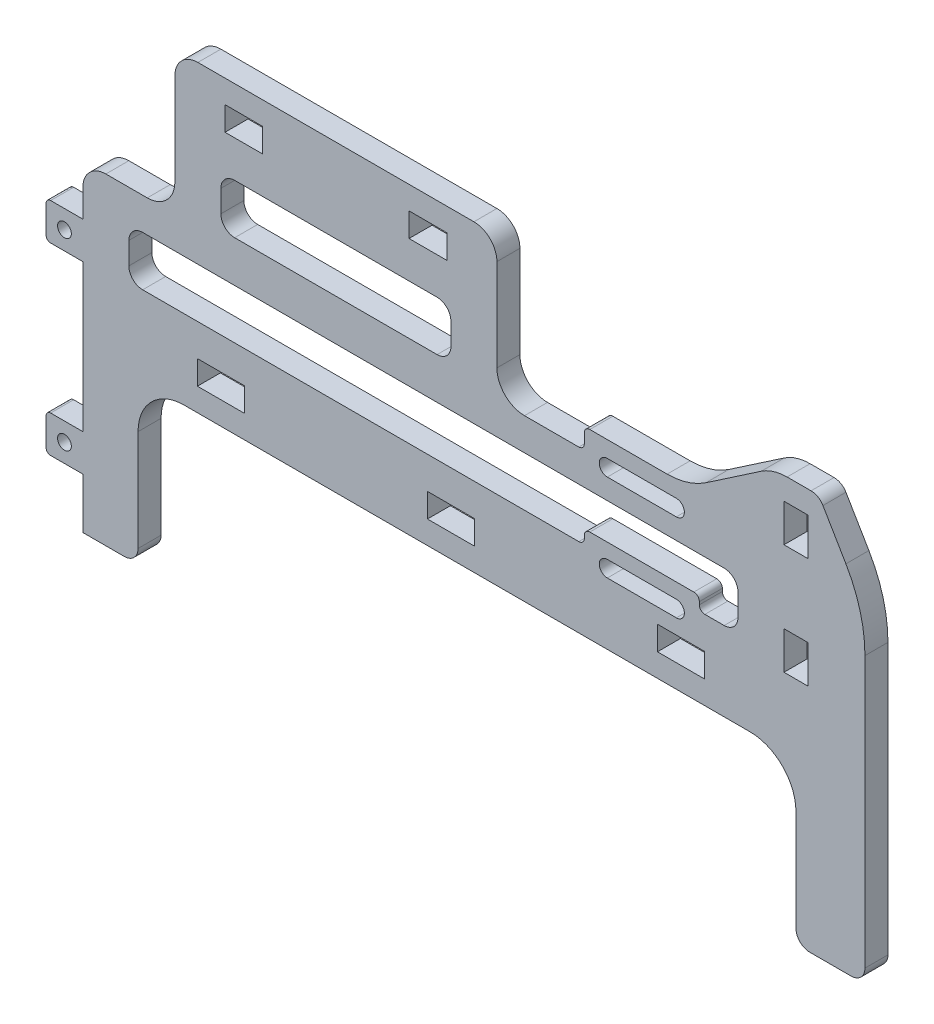
from build123d import *

# Parameters (mm, degrees)
SALIENTE_EXTRUIR1_DEPTH = 5
CROQUIS2_W              = 143
CROQUIS2_H              = 35
CORTAR_EXTRUIR1_DEPTH   = 5
REDONDEO1_R             = 10
CROQUIS3_W              = 5
CROQUIS3_H              = 8
SALIENTE_EXTRUIR2_DEPTH = 8
REDONDEO2_R             = 30
REDONDEO3_R             = 3
CROQUIS4_W              = 5.2
CROQUIS4_H              = 8.2
CORTAR_EXTRUIR2_DEPTH   = 192.034028382
REDONDEO4_R             = 3
REDONDEO5_R             = 10
REDONDEO6_R             = 1
CROQUIS5_R              = 1.5
CORTAR_EXTRUIR3_DEPTH   = 5
CROQUIS6_W              = 10.2
CROQUIS6_H              = 5.2
CORTAR_EXTRUIR4_DEPTH   = 5
CROQUIS7_W              = 132.4
CROQUIS7_H              = 10.8
CORTAR_EXTRUIR5_DEPTH   = 5
CROQUIS8_W              = 70
CROQUIS8_H              = 31
SALIENTE_EXTRUIR3_DEPTH = 5
CROQUIS9_W              = 8.2
CROQUIS9_H              = 5.2
CORTAR_EXTRUIR6_DEPTH   = 5
CROQUIS10_W             = 50
CROQUIS10_H             = 10.8
CORTAR_EXTRUIR7_DEPTH   = 5
REDONDEO9_R             = 3
REDONDEO10_R            = 6
REDONDEO11_R            = 5
REDONDEO12_R            = 5
CROQUIS12_W             = 22.569775484
CROQUIS12_H             = 11.5
CROQUIS12_W_2           = 25
CROQUIS12_H_2           = 3
SALIENTE_EXTRUIR4_DEPTH = 5
CORTAR_EXTRUIR8_DEPTH   = 5
REDONDEO8_R             = 3
REDONDEO13_R            = 1.2
REDONDEO14_R            = 15


with BuildPart() as part:
    # Croquis1 → Saliente-Extruir1 (new body)
    with BuildSketch(Plane.XY):
        Polygon((0, 0), (0, 70), (125, 70), (150, 87), (160, 87), (170, 70), (170, 0), align=None)
    extrude(amount=SALIENTE_EXTRUIR1_DEPTH)

    # Croquis2 → Cortar-Extruir1 (cut)
    with BuildSketch(Plane.XY.offset(5)):
        with Locations((83.5, 17.5)):
            Rectangle(CROQUIS2_W, CROQUIS2_H)
    extrude(amount=-CORTAR_EXTRUIR1_DEPTH, mode=Mode.SUBTRACT)

    # Redondeo1
    redondeo1_edges = [part.edges().sort_by_distance(p)[0] for p in [
        (12, 35, 2.5),
        (155, 35, 2.5),
    ]]
    fillet(redondeo1_edges, radius=REDONDEO1_R)

    # Croquis3 → Saliente-Extruir2 (add)
    with BuildSketch(Plane.ZY):
        with Locations((2.5, 15)):
            Rectangle(CROQUIS3_W, CROQUIS3_H)
        with Locations((2.5, 55)):
            Rectangle(CROQUIS3_W, CROQUIS3_H)
    extrude(amount=SALIENTE_EXTRUIR2_DEPTH)

    # Redondeo2
    redondeo2_edges = [part.edges().sort_by_distance(p)[0] for p in [
        (125, 70, 2.5),
        (170, 70, 2.5),
    ]]
    fillet(redondeo2_edges, radius=REDONDEO2_R)

    # Redondeo3
    redondeo3_edges = [part.edges().sort_by_distance(p)[0] for p in [
        (170, 0, 2.5),
        (12, 0, 2.5),
        (155, 0, 2.5),
    ]]
    fillet(redondeo3_edges, radius=REDONDEO3_R)

    # Croquis4 → Cortar-Extruir2 (cut, through all)
    with BuildSketch(Plane.XY.offset(5)):
        with Locations((155, 78)):
            Rectangle(CROQUIS4_W, CROQUIS4_H)
        with Locations((155, 54)):
            Rectangle(CROQUIS4_W, CROQUIS4_H)
    extrude(amount=-CORTAR_EXTRUIR2_DEPTH, mode=Mode.SUBTRACT)

    # Redondeo4
    redondeo4_edges = [part.edges().sort_by_distance(p)[0] for p in [
        (160, 87, 2.5),
    ]]
    fillet(redondeo4_edges, radius=REDONDEO4_R)

    # Redondeo5
    redondeo5_edges = [part.edges().sort_by_distance(p)[0] for p in [
        (150, 87, 2.5),
    ]]
    fillet(redondeo5_edges, radius=REDONDEO5_R)

    # Redondeo6
    redondeo6_edges = [part.edges().sort_by_distance(p)[0] for p in [
        (-8, 19, 2.5),
        (-8, 11, 2.5),
        (-8, 59, 2.5),
        (-8, 51, 2.5),
    ]]
    fillet(redondeo6_edges, radius=REDONDEO6_R)

    # Croquis5 → Cortar-Extruir3 (cut)
    with BuildSketch(Plane.XY.offset(5)):
        with Locations((-4, 55)):
            Circle(CROQUIS5_R)
        with Locations((-4, 15)):
            Circle(CROQUIS5_R)
    extrude(amount=-CORTAR_EXTRUIR3_DEPTH, mode=Mode.SUBTRACT)

    # Croquis6 → Cortar-Extruir4 (cut)
    with BuildSketch(Plane.XY.offset(5)):
        with Locations((80, 42.6)):
            Rectangle(CROQUIS6_W, CROQUIS6_H)
        with Locations((30, 42.6)):
            Rectangle(CROQUIS6_W, CROQUIS6_H)
        with Locations((130, 42.6)):
            Rectangle(CROQUIS6_W, CROQUIS6_H)
    extrude(amount=-CORTAR_EXTRUIR4_DEPTH, mode=Mode.SUBTRACT)

    # Croquis7 → Cortar-Extruir5 (cut)
    with BuildSketch(Plane.XY.offset(5)):
        with Locations((76.2, 57.6)):
            Rectangle(CROQUIS7_W, CROQUIS7_H)
    extrude(amount=-CORTAR_EXTRUIR5_DEPTH, mode=Mode.SUBTRACT)

    # Croquis8 → Saliente-Extruir3 (add)
    with BuildSketch(Plane.XY.offset(5)):
        with Locations((55, 85.5)):
            Rectangle(CROQUIS8_W, CROQUIS8_H)
    extrude(amount=-SALIENTE_EXTRUIR3_DEPTH)

    # Croquis9 → Cortar-Extruir6 (cut)
    with BuildSketch(Plane.XY.offset(5)):
        with Locations((35, 93.4)):
            Rectangle(CROQUIS9_W, CROQUIS9_H)
        with Locations((75, 93.4)):
            Rectangle(CROQUIS9_W, CROQUIS9_H)
    extrude(amount=-CORTAR_EXTRUIR6_DEPTH, mode=Mode.SUBTRACT)

    # Croquis10 → Cortar-Extruir7 (cut)
    with BuildSketch(Plane.XY.offset(5)):
        with Locations((55, 77.4)):
            Rectangle(CROQUIS10_W, CROQUIS10_H)
    extrude(amount=-CORTAR_EXTRUIR7_DEPTH, mode=Mode.SUBTRACT)

    # Redondeo9
    redondeo9_edges = [part.edges().sort_by_distance(p)[0] for p in [
        (30, 72, 2.5),
        (30, 82.8, 2.5),
        (80, 82.8, 2.5),
        (80, 72, 2.5),
    ]]
    fillet(redondeo9_edges, radius=REDONDEO9_R)

    # Redondeo10
    redondeo10_edges = [part.edges().sort_by_distance(p)[0] for p in [
        (20, 70, 2.5),
        (90, 70, 2.5),
    ]]
    fillet(redondeo10_edges, radius=REDONDEO10_R)

    # Redondeo11
    redondeo11_edges = [part.edges().sort_by_distance(p)[0] for p in [
        (20, 101, 2.5),
        (90, 101, 2.5),
    ]]
    fillet(redondeo11_edges, radius=REDONDEO11_R)

    # Redondeo12
    redondeo12_edges = [part.edges().sort_by_distance(p)[0] for p in [
        (0, 70, 2.5),
    ]]
    fillet(redondeo12_edges, radius=REDONDEO12_R)

    # Croquis12 → Saliente-Extruir4 (add)
    with BuildSketch(Plane.XY.offset(5)):
        with Locations((120.284887742, 68.75)):
            Rectangle(CROQUIS12_W, CROQUIS12_H)
        with Locations((121.5, 53.7)):
            Rectangle(CROQUIS12_W_2, CROQUIS12_H_2)
    extrude(amount=-SALIENTE_EXTRUIR4_DEPTH)

    # Croquis11 → Cortar-Extruir8 (cut)
    with BuildSketch(Plane.XY.offset(5)):
        with BuildLine():
            Line((129, 48.45), (114, 48.45))
            ThreePointArc((114, 48.45), (112.25, 50.2), (114, 51.95))
            Line((114, 51.95), (129, 51.95))
            ThreePointArc((129, 51.95), (130.75, 50.2), (129, 48.45))
        make_face()
        with BuildLine():
            Line((129, 67.45), (114, 67.45))
            ThreePointArc((114, 67.45), (112.25, 69.2), (114, 70.95))
            Line((114, 70.95), (129, 70.95))
            ThreePointArc((129, 70.95), (130.75, 69.2), (129, 67.45))
        make_face()
    extrude(amount=-CORTAR_EXTRUIR8_DEPTH, mode=Mode.SUBTRACT)

    # Redondeo8
    redondeo8_edges = [part.edges().sort_by_distance(p)[0] for p in [
        (10, 52.2, 2.5),
        (10, 63, 2.5),
        (142.4, 63, 2.5),
        (142.4, 52.2, 2.5),
    ]]
    fillet(redondeo8_edges, radius=REDONDEO8_R)

    # Redondeo13
    redondeo13_edges = [part.edges().sort_by_distance(p)[0] for p in [
        (109, 70, 2.5),
        (109, 74.5, 2.5),
        (134, 55.2, 2.5),
        (134, 52.2, 2.5),
        (109, 52.2, 2.5),
        (109, 55.2, 2.5),
    ]]
    fillet(redondeo13_edges, radius=REDONDEO13_R)

    # Redondeo14
    redondeo14_edges = [part.edges().sort_by_distance(p)[0] for p in [
        (131.569775484, 74.5, 2.5),
    ]]
    fillet(redondeo14_edges, radius=REDONDEO14_R)


solid = part.part
